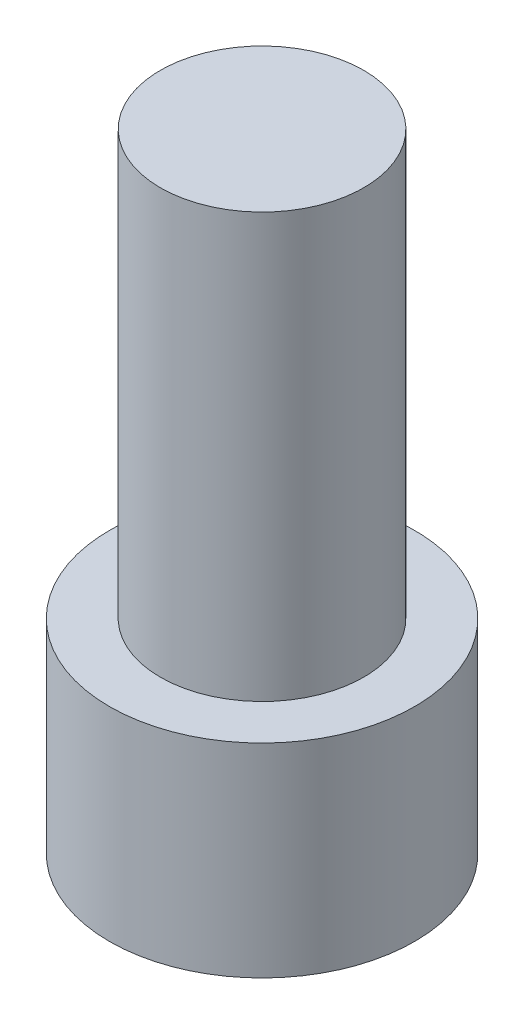
from build123d import *

# Parameters (mm, degrees)
SKETCH1_R           = 9
BOSS_EXTRUDE1_DEPTH = 12
SKETCH2_R           = 6
BOSS_EXTRUDE2_DEPTH = 25


with BuildPart() as part:
    # Sketch1 → Boss-Extrude1 (new body)
    with BuildSketch(Plane(origin=(0, 0, 0), x_dir=(1, 0, 0), z_dir=(0, 1, 0))):
        with Locations(Location((0, 0, 0), (0, 0, 270))):
            Circle(SKETCH1_R)
    extrude(amount=BOSS_EXTRUDE1_DEPTH)

    # Sketch2 → Boss-Extrude2 (add)
    with BuildSketch(Plane(origin=(0, 12, 0), x_dir=(1, 0, 0), z_dir=(0, 1, 0))):
        with Locations(Location((0, 0, 0), (0, 0, 270))):
            Circle(SKETCH2_R)
    extrude(amount=BOSS_EXTRUDE2_DEPTH)


solid = part.part
